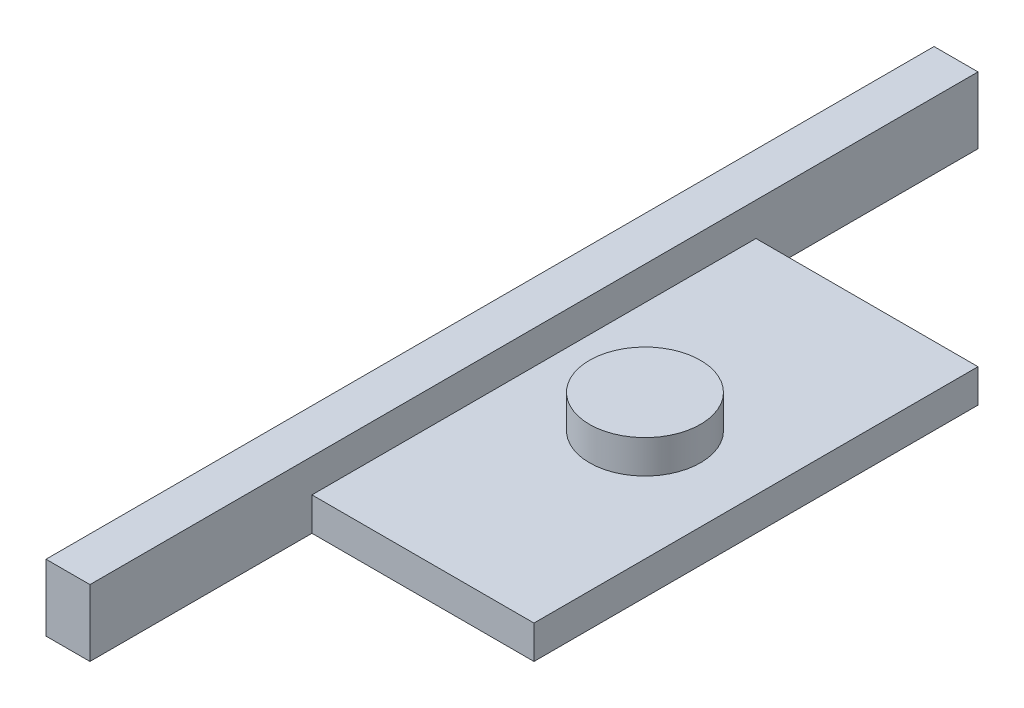
from build123d import *

# Parameters (mm, degrees)
CROQUIS1_R                 = 11
CROQUIS1_R_2               = 2
CROQUIS1_W                 = 30
CROQUIS1_H                 = 3
SALIENTE_EXTRUIR1_DEPTH    = 3
CROQUIS2_R                 = 13
CROQUIS2_R_2               = 11
SALIENTE_EXTRUIR2_DEPTH    = 4
CROQUIS3_R                 = 13
CROQUIS3_R_2               = 9
SALIENTE_EXTRUIR3_DEPTH    = 2
CHAFL_N1_SIZE              = 2
CHAFL_N2_SIZE              = 10
CROQUIS6_W                 = 10
CROQUIS6_H                 = 20
CROQUIS6_R                 = 2.5
CORTAR_EXTRUIR2_DEPTH      = 1.5
CORTAR_EXTRUIR3_DEPTH      = 10
CORTAR_EXTRUIR3_DEPTH_BACK = 10
CROQUIS7_OUTSIDE_W         = 171.176
CROQUIS7_OUTSIDE_H         = 71.176
CROQUIS7_OUTSIDE_W_2       = 13.478659513
CROQUIS7_OUTSIDE_H_2       = 41.596343219


with BuildPart() as part:
    # Croquis1 → Saliente-Extruir1 (new body)
    with BuildSketch(Plane(origin=(0, 0, 0), x_dir=(1, 0, 0), z_dir=(0, 1, 0))):
        Polygon((-65, -20), (65, -20), (65, -10), (75, -10), (75, 10), (65, 10), (65, 20), (-65, 20), align=None)
        with Locations((-50.129942902, 0)):
            Circle(CROQUIS1_R, mode=Mode.SUBTRACT)
        with Locations((-28.595127909, 0)):
            Circle(CROQUIS1_R_2, mode=Mode.SUBTRACT)
        with Locations((-13.595127909, 0)):
            Circle(CROQUIS1_R_2, mode=Mode.SUBTRACT)
        with Locations((50, 0)):
            Circle(CROQUIS1_R_2, mode=Mode.SUBTRACT)
        with Locations((25, 11)):
            Rectangle(CROQUIS1_W, CROQUIS1_H, mode=Mode.SUBTRACT)
        with Locations((25, -11)):
            Rectangle(CROQUIS1_W, CROQUIS1_H, mode=Mode.SUBTRACT)
    extrude(amount=SALIENTE_EXTRUIR1_DEPTH)

    # Croquis2 → Saliente-Extruir2 (add)
    with BuildSketch(Plane(origin=(0, 3, 0), x_dir=(1, 0, 0), z_dir=(0, 1, 0))):
        with Locations((-50.129942902, 0)):
            Circle(CROQUIS2_R)
        with Locations((-50.129942902, 0)):
            Circle(CROQUIS2_R_2, mode=Mode.SUBTRACT)
    extrude(amount=SALIENTE_EXTRUIR2_DEPTH)

    # Croquis3 → Saliente-Extruir3 (add)
    with BuildSketch(Plane(origin=(0, 7, 0), x_dir=(1, 0, 0), z_dir=(0, 1, 0))):
        with Locations((-50.129942902, 0)):
            Circle(CROQUIS3_R)
        with Locations((-50.129942902, 0)):
            Circle(CROQUIS3_R_2, mode=Mode.SUBTRACT)
    extrude(amount=SALIENTE_EXTRUIR3_DEPTH)

    # Chaflán1
    chafl_n1_edges = [part.edges().sort_by_distance(p)[0] for p in [
        (-63.129942902, 9, 0),
    ]]
    chamfer(chafl_n1_edges, length=CHAFL_N1_SIZE)

    # Chaflán2
    chafl_n2_edges = [part.edges().sort_by_distance(p)[0] for p in [
        (-65, 1.5, 20),
        (-65, 1.5, -20),
    ]]
    chamfer(chafl_n2_edges, length=CHAFL_N2_SIZE)

    # Croquis6 → Cortar-Extruir2 (cut)
    with BuildSketch(Plane(origin=(0, 3, 0), x_dir=(1, 0, 0), z_dir=(0, 1, 0))):
        with Locations((70, 0)):
            Rectangle(CROQUIS6_W, CROQUIS6_H)
        with Locations((70, 0)):
            Circle(CROQUIS6_R, mode=Mode.SUBTRACT)
    extrude(amount=-CORTAR_EXTRUIR2_DEPTH, mode=Mode.SUBTRACT)

    # Croquis7 outside → Cortar-Extruir3 (cut, two sides: drawn at the far end of the back side and taken through both)
    with BuildSketch(Plane(origin=(0, 3, 0), x_dir=(1, 0, 0), z_dir=(0, 1, 0)).offset(-CORTAR_EXTRUIR3_DEPTH_BACK)):
        with Locations((5, 0)):
            Rectangle(CROQUIS7_OUTSIDE_W, CROQUIS7_OUTSIDE_H)
        with Locations((69.759812965, -0.79817161)):
            Rectangle(CROQUIS7_OUTSIDE_W_2, CROQUIS7_OUTSIDE_H_2, mode=Mode.SUBTRACT)
    extrude(amount=CORTAR_EXTRUIR3_DEPTH + CORTAR_EXTRUIR3_DEPTH_BACK, mode=Mode.SUBTRACT)


solid = part.part
